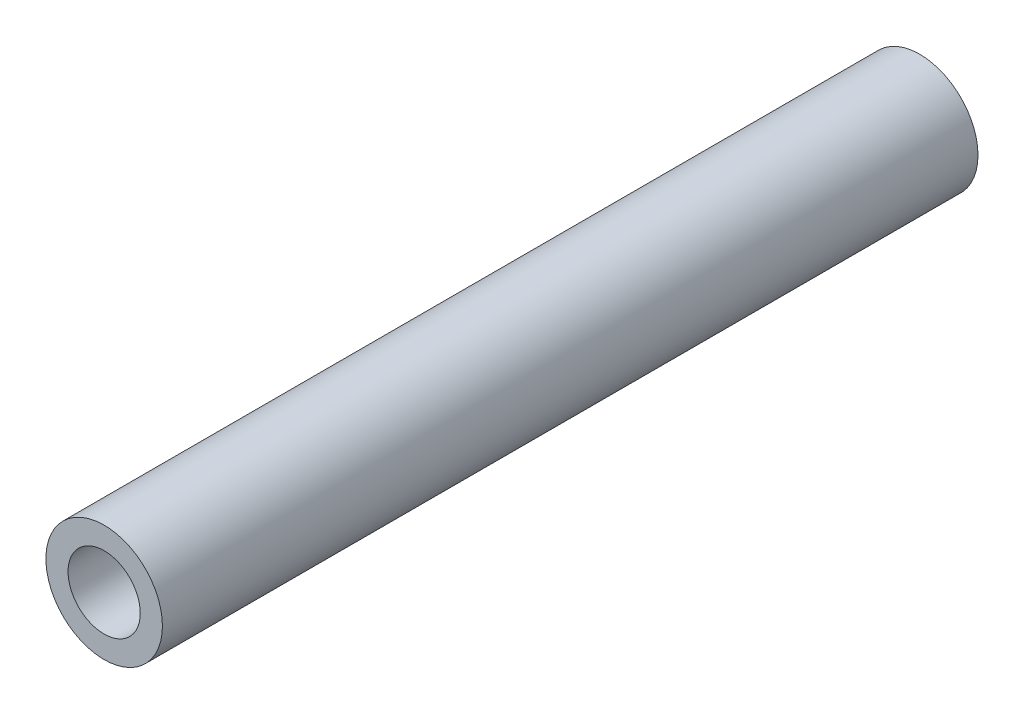
from build123d import *

# Parameters (mm, degrees)
SKETCH_1_R      = 2.5
SKETCH_1_R_2    = 1.55
EXTRUDE_1_DEPTH = 35


with BuildPart() as part:
    # 草图1 → 凸台-拉伸1 (new body)
    with BuildSketch(Plane.XY):
        Circle(SKETCH_1_R)
        Circle(SKETCH_1_R_2, mode=Mode.SUBTRACT)
    extrude(amount=EXTRUDE_1_DEPTH)


solid = part.part
